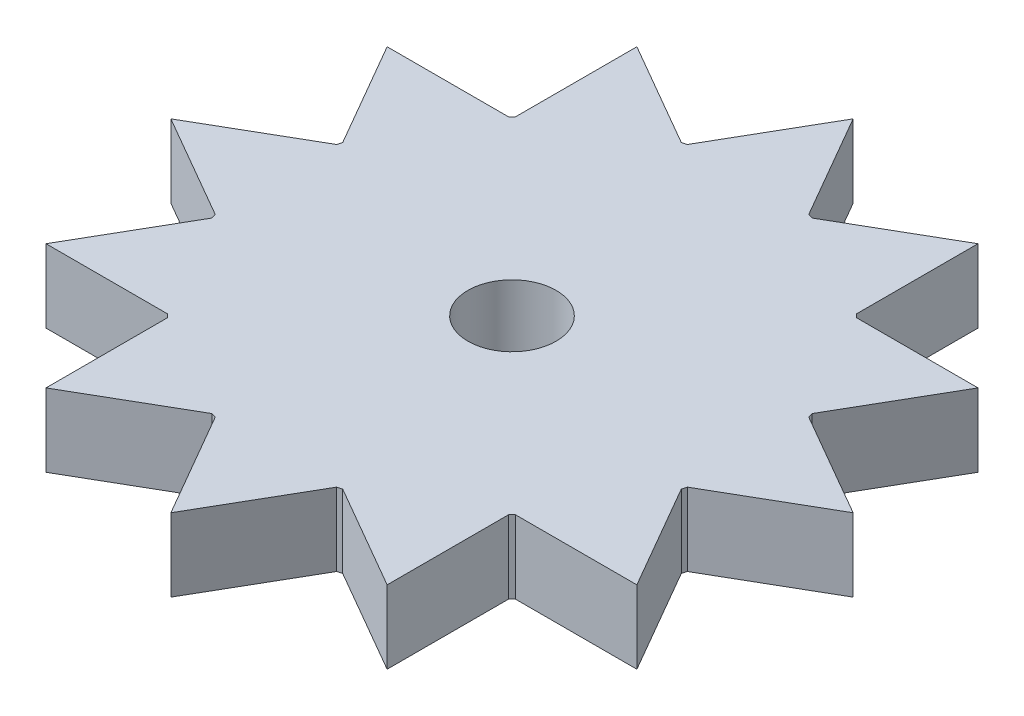
from build123d import *

# Parameters (mm, degrees)
SKETCH1_R           = 10
BOSS_EXTRUDE1_DEPTH = 3
BOSS_EXTRUDE2_DEPTH = 3
CIRPATTERN1_COUNT   = 12
SKETCH3_R           = 1.81
CUT_EXTRUDE1_DEPTH  = 3


with BuildPart() as part:
    # Sketch1 → Boss-Extrude1 (new body)
    with BuildSketch(Plane(origin=(0, 0, 0), x_dir=(1, 0, 0), z_dir=(0, 1, 0))):
        with Locations(Location((0, 0, 0), (0, 0, 270))):
            Circle(SKETCH1_R)
    extrude(amount=BOSS_EXTRUDE1_DEPTH)

    # Sketch2 → Boss-Extrude2 (add)
    with BuildSketch(Plane(origin=(0, 3, 0), x_dir=(1, 0, 0), z_dir=(0, 1, 0))):
        Polygon((0, 14), (-2.491463612, 9.684658438), (2.491463612, 9.684658438), align=None)
    boss_extrude2 = extrude(amount=-BOSS_EXTRUDE2_DEPTH)

    # CirPattern1: Boss-Extrude2 ×12 about axis
    cirpattern1_axis = Axis((0, 0, 0), (0, 1, 0))
    for i in range(1, CIRPATTERN1_COUNT):
        add(boss_extrude2.rotate(cirpattern1_axis, i * 360 / CIRPATTERN1_COUNT))

    # Sketch3 → Cut-Extrude1 (cut)
    with BuildSketch(Plane(origin=(0, 3, 0), x_dir=(1, 0, 0), z_dir=(0, 1, 0))):
        with Locations(Location((0, 0, 0), (0, 0, 270))):
            Circle(SKETCH3_R)
    extrude(amount=-CUT_EXTRUDE1_DEPTH, mode=Mode.SUBTRACT)


solid = part.part
